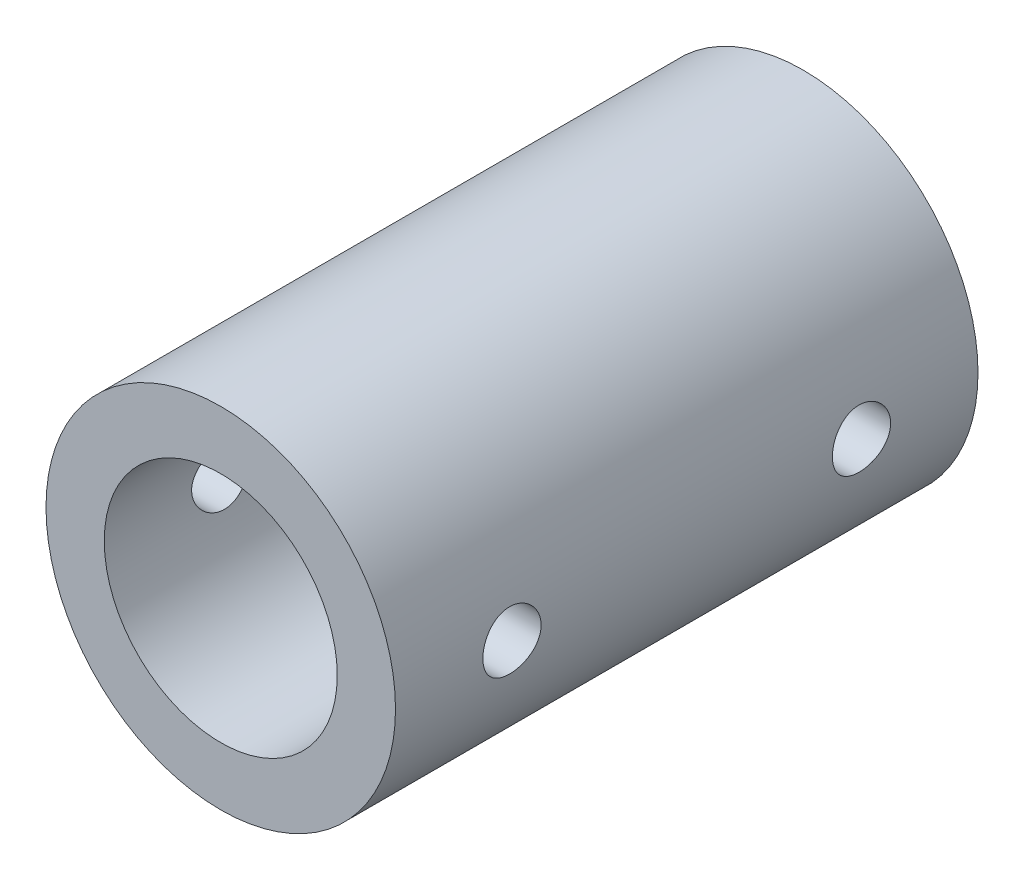
from build123d import *

# Parameters (mm, degrees)
SKETCH1_R           = 6
SKETCH1_R_2         = 4
BOSS_EXTRUDE1_DEPTH = 10
SKETCH2_R           = 1
CUT_EXTRUDE1_DEPTH  = 10


with BuildPart() as part:
    # Sketch1 → Boss-Extrude1 (new, symmetric)
    with BuildSketch(Plane.XY):
        Circle(SKETCH1_R)
        Circle(SKETCH1_R_2, mode=Mode.SUBTRACT)
    extrude(amount=BOSS_EXTRUDE1_DEPTH, both=True)

    # Sketch2 → Cut-Extrude1 (cut, symmetric)
    with BuildSketch(Plane(origin=(0, 0, 0), x_dir=(0, 0, -1), z_dir=(1, 0, 0))):
        with Locations((-6, 0)):
            Circle(SKETCH2_R)
    cut_extrude1 = extrude(amount=CUT_EXTRUDE1_DEPTH, both=True, mode=Mode.SUBTRACT)

    # Mirror1: Cut-Extrude1 across plane
    add(cut_extrude1.mirror(Plane.XY), mode=Mode.SUBTRACT)


solid = part.part
